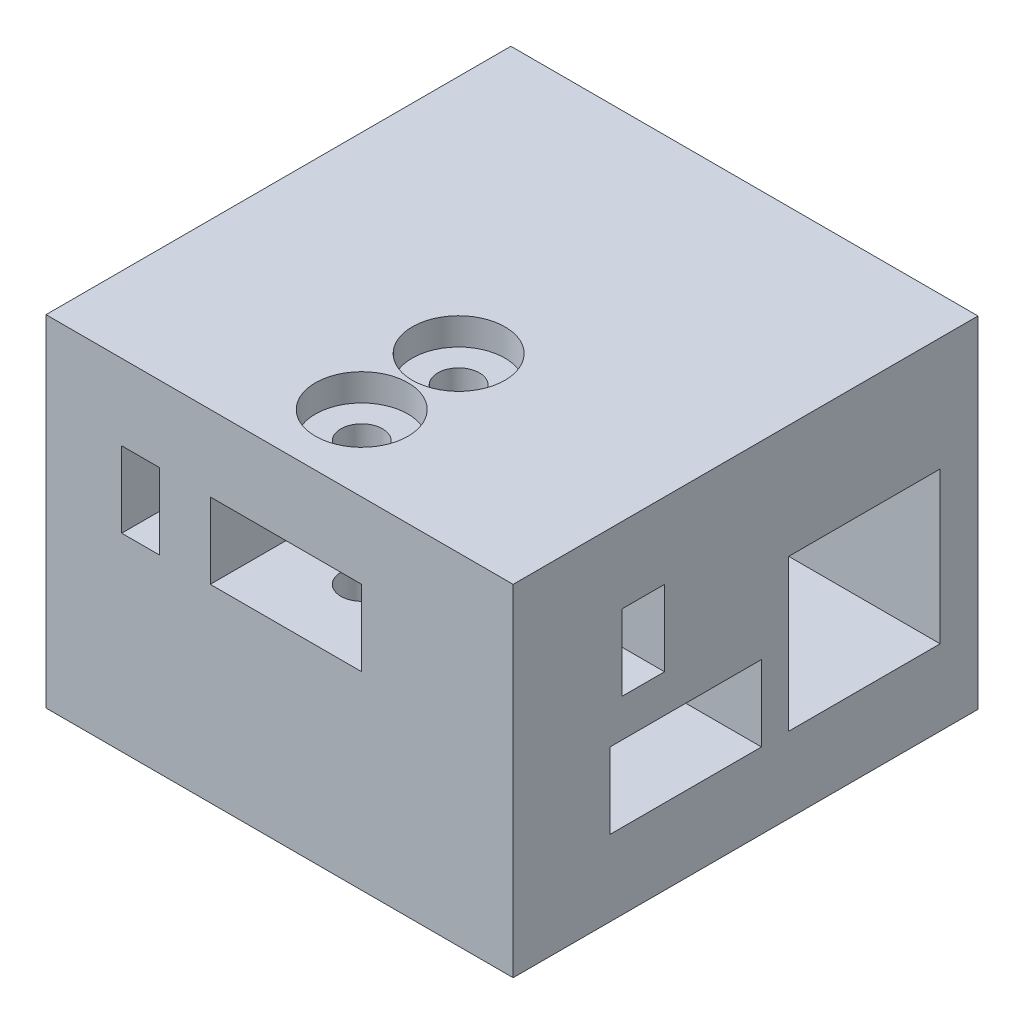
from build123d import *

# Parameters (mm, degrees)
MAIN_BLOCK_DEPTH                        = 45
BOTTOM_IDLER_CUTOUT_DEPTH               = 10
TOP_IDLER_CUTOUT_DEPTH                  = 10
BELT_PASSTHROUGH_SKETCH_W               = 5
BELT_PASSTHROUGH_SKETCH_H               = 61.4
BELT_PASSTHROUGH_DEPTH                  = 10
F_2020VSLOTCUTOUTSKETCH_W               = 20
F_2020VSLOTCUTOUTSKETCH_H               = 20
EXTRUSIONMOUNTINGSLOT_DEPTH             = 20
CBORE_FOR_M5_HEX_HEAD_BOLT1_D           = 5.5
CBORE_FOR_M5_HEX_HEAD_BOLT1_CBORE_D     = 12.24
CBORE_FOR_M5_HEX_HEAD_BOLT1_CBORE_DEPTH = 3.58
NUTTRAPS_DEPTH                          = 4
EXTRUSIONMOUNTINGCOUNTERBORESKETCH_R    = 4.5
EXTRUSIONMOUNTINGCOUNTERBORE_DEPTH      = 31.7
EXTRUSIONMOUNTINGHOLESKETCH_R           = 2.65
EXTRUSIONMOUNTINGHOLE_DEPTH             = 66.991287304


with BuildPart() as part:
    # MainBlockSketch → Main Block (new body)
    with BuildSketch(Plane(origin=(0, 0, 0), x_dir=(1, 0, 0), z_dir=(0, 1, 0))):
        Polygon((-41.7, -36.4), (20, -36.4), (20, -20), (20, -15), (20, 0), (20, 20), (20, 25), (-41.7, 25), (-41.7, 20), (-41.7, -15), align=None)
    extrude(amount=MAIN_BLOCK_DEPTH)

    # Bottom Idler Cutout Sketch → Bottom Idler Cutout (cut)
    with BuildSketch(Plane(origin=(0, 10, 0), x_dir=(1, 0, 0), z_dir=(0, 1, 0))):
        with BuildLine():
            Line((-10, -23.6), (20, -23.6))
            Line((20, -23.6), (20, -3.6))
            Line((20, -3.6), (-10, -3.6))
            ThreePointArc((-10, -3.6), (-12.588190451, -3.940741737), (-15, -4.939745962))
            Line((-15, -4.939745962), (-15, 25))
            Line((-15, 25), (-20, 25))
            Line((-20, 25), (-20, -13.6))
            ThreePointArc((-20, -13.6), (-17.071067812, -20.671067812), (-10, -23.6))
        make_face()
    extrude(amount=BOTTOM_IDLER_CUTOUT_DEPTH, mode=Mode.SUBTRACT)

    # Top Idler Cutout Sketch → Top Idler Cutout (cut)
    with BuildSketch(Plane(origin=(0, 25, 0), x_dir=(1, 0, 0), z_dir=(0, 1, 0))):
        with BuildLine():
            Line((-20, -26.4), (-20, -36.4))
            Line((-20, -36.4), (0, -36.4))
            Line((0, -36.4), (0, -26.4))
            ThreePointArc((0, -26.4), (-0.258342613, -24.141657387), (-1.020022272, -22))
            Line((-1.020022272, -22), (20, -22))
            Line((20, -22), (20, -16.4))
            Line((20, -16.4), (-10, -16.4))
            ThreePointArc((-10, -16.4), (-17.071067812, -19.328932188), (-20, -26.4))
        make_face()
    extrude(amount=TOP_IDLER_CUTOUT_DEPTH, mode=Mode.SUBTRACT)

    # Belt Passthrough Sketch → Belt Passthrough (cut)
    with BuildSketch(Plane(origin=(0, 25, 0), x_dir=(1, 0, 0), z_dir=(0, 1, 0))):
        with Locations((-29.2, -5.7)):
            Rectangle(BELT_PASSTHROUGH_SKETCH_W, BELT_PASSTHROUGH_SKETCH_H)
    extrude(amount=BELT_PASSTHROUGH_DEPTH, mode=Mode.SUBTRACT)

    # 2020VSlotCutoutSketch → ExtrusionMountingSlot (cut)
    with BuildSketch(Plane(origin=(0, 10, 0), x_dir=(1, 0, 0), z_dir=(0, 1, 0))):
        with Locations((10, 10)):
            Rectangle(F_2020VSLOTCUTOUTSKETCH_W, F_2020VSLOTCUTOUTSKETCH_H)
    extrude(amount=EXTRUSIONMOUNTINGSLOT_DEPTH, mode=Mode.SUBTRACT)

    # CBORE for M5 Hex Head Bolt1 (through all)
    with Locations(Plane(origin=(0, 45, 0), x_dir=(1, 0, 0), z_dir=(0, 1, 0))):
        with Locations((-10, -26.4), (-10, -13.6)):
            CounterBoreHole(CBORE_FOR_M5_HEX_HEAD_BOLT1_D / 2, CBORE_FOR_M5_HEX_HEAD_BOLT1_CBORE_D / 2, CBORE_FOR_M5_HEX_HEAD_BOLT1_CBORE_DEPTH)

    # Nut Trap Sketch → NutTraps (cut)
    with BuildSketch(Plane(origin=(0, 0, 0), x_dir=(1, 0, 0), z_dir=(0, 1, 0))):
        Polygon((-7.632863896, -9.5), (-12.367136104, -9.5), (-14.734272207, -13.6), (-12.367136104, -17.7), (-7.632863896, -17.7), (-5.265727793, -13.6), align=None)
        Polygon((-7.632863896, -22.3), (-12.367136104, -22.3), (-14.734272207, -26.4), (-12.367136104, -30.5), (-7.632863896, -30.5), (-5.265727793, -26.4), align=None)
    extrude(amount=NUTTRAPS_DEPTH, mode=Mode.SUBTRACT)

    # ExtrusionMountingCounterBoreSketch → ExtrusionMountingCounterbore (cut)
    with BuildSketch(Plane(origin=(-41.7, 0, 0), x_dir=(0, 0, -1), z_dir=(1, 0, 0))):
        with Locations(Location((10, 20, 0), (0, 0, 180))):
            Circle(EXTRUSIONMOUNTINGCOUNTERBORESKETCH_R)
    extrude(amount=EXTRUSIONMOUNTINGCOUNTERBORE_DEPTH, mode=Mode.SUBTRACT)

    # ExtrusionMountingHoleSketch → extrusionMountingHole (cut, through all)
    with BuildSketch(Plane.ZY.offset(10)):
        with Locations((-10, 20)):
            Circle(EXTRUSIONMOUNTINGHOLESKETCH_R)
    extrude(amount=-EXTRUSIONMOUNTINGHOLE_DEPTH, mode=Mode.SUBTRACT)


solid = part.part
